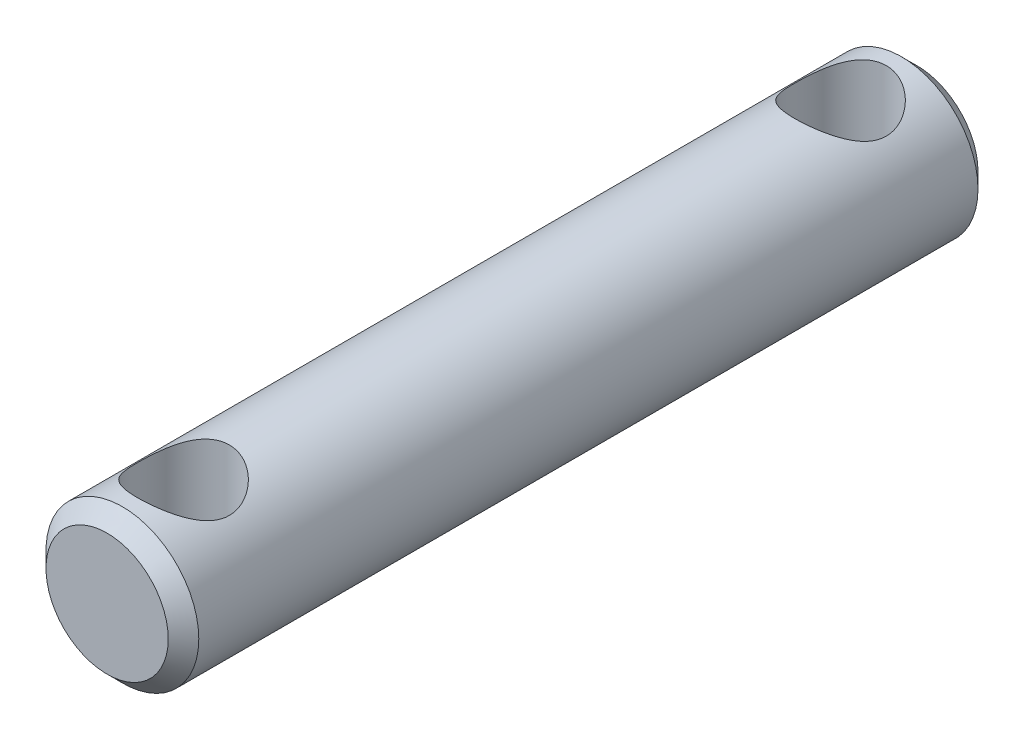
from build123d import *

# Parameters (mm, degrees)
SKIZZE1_R                       = 5
AUFSATZ_LINEAR_AUSTRAGEN1_DEPTH = 53
SKIZZE2_R                       = 3
SCHNITT_LINEAR_AUSTRAGEN1_DEPTH = 47
FASE1_SIZE                      = 1


with BuildPart() as part:
    # Skizze1 → Aufsatz-Linear austragen1 (new body)
    with BuildSketch(Plane.XY):
        Circle(SKIZZE1_R)
    extrude(amount=AUFSATZ_LINEAR_AUSTRAGEN1_DEPTH)

    # Skizze2 → Schnitt-Linear austragen1 (cut)
    with BuildSketch(Plane(origin=(0, 5, 0), x_dir=(1, 0, 0), z_dir=(0, 1, 0))):
        with Locations(Location((0, -5, 0), (0, 0, 270))):
            Circle(SKIZZE2_R)
        with Locations(Location((0, -48, 0), (0, 0, 270))):
            Circle(SKIZZE2_R)
    extrude(amount=-SCHNITT_LINEAR_AUSTRAGEN1_DEPTH, mode=Mode.SUBTRACT)

    # Fase1
    fase1_edges = [part.edges().sort_by_distance(p)[0] for p in [
        (-5, 0, 0),
        (-5, 0, 53),
    ]]
    chamfer(fase1_edges, length=FASE1_SIZE)


solid = part.part
